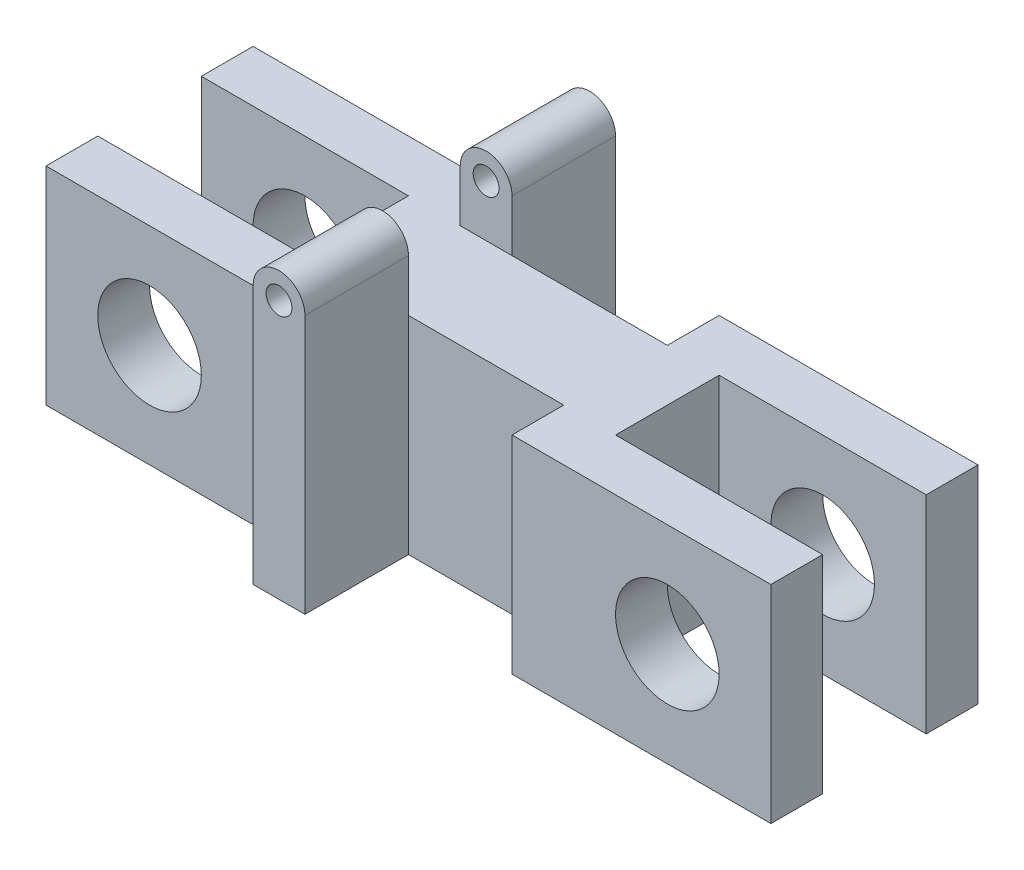
from build123d import *

# Parameters (mm, degrees)
SKETCH1_W               = 70
SKETCH1_H               = 20
BOSS_EXTRUDE1_DEPTH     = 20
SKETCH2_W               = 10
SKETCH2_H               = 20
CUT_EXTRUDE1_DEPTH      = 20
SKETCH3_R               = 5
CUT_EXTRUDE2_DEPTH      = 60
SKETCH4_W               = 10
SKETCH4_H               = 20
CUT_EXTRUDE3_DEPTH      = 5
MIRROR3_COPY_1_SKETCH_W = 10
MIRROR3_COPY_1_SKETCH_H = 20
MIRROR3_COPY_1_DEPTH    = 5
SKETCH7_R               = 1.25
BOSS_EXTRUDE2_DEPTH     = 10


with BuildPart() as part:
    # Sketch1 → Boss-Extrude1 (new body)
    with BuildSketch(Plane.XY):
        Rectangle(SKETCH1_W, SKETCH1_H)
    extrude(amount=BOSS_EXTRUDE1_DEPTH)

    # Sketch2 → Cut-Extrude1 (cut)
    with BuildSketch(Plane.ZY.offset(35)):
        with Locations((10, 0)):
            Rectangle(SKETCH2_W, SKETCH2_H)
    cut_extrude1 = extrude(amount=-CUT_EXTRUDE1_DEPTH, mode=Mode.SUBTRACT)

    # Sketch3 → Cut-Extrude2 (cut)
    with BuildSketch(Plane.XY.offset(20)):
        with Locations((-25, 0)):
            Circle(SKETCH3_R)
    cut_extrude2 = extrude(amount=-CUT_EXTRUDE2_DEPTH, mode=Mode.SUBTRACT)

    # Sketch4 → Cut-Extrude3 (cut)
    with BuildSketch(Plane.XY.offset(20)):
        with Locations((-5, 0)):
            Rectangle(SKETCH4_W, SKETCH4_H)
    cut_extrude3 = extrude(amount=-CUT_EXTRUDE3_DEPTH, mode=Mode.SUBTRACT)

    # Mirror2: Cut-Extrude3 across plane
    add(cut_extrude3.mirror(Plane.XY.offset(10)), mode=Mode.SUBTRACT)

    # Mirror3: Cut-Extrude1, Cut-Extrude2, Cut-Extrude3 across plane
    add(cut_extrude1.mirror(Plane(origin=(0, 0, 0), x_dir=(0, 0, 1), z_dir=(1, 0, 0))), mode=Mode.SUBTRACT)
    add(cut_extrude2.mirror(Plane(origin=(0, 0, 0), x_dir=(0, 0, 1), z_dir=(1, 0, 0))), mode=Mode.SUBTRACT)
    add(cut_extrude3.mirror(Plane(origin=(0, 0, 0), x_dir=(0, 0, 1), z_dir=(1, 0, 0))), mode=Mode.SUBTRACT)

    # Mirror3 copy 1 sketch → Mirror3 copy 1 (cut)
    with BuildSketch(Plane(origin=(0, 0, 0), x_dir=(-1, 0, 0), z_dir=(0, 0, -1))):
        with Locations((-5, 0)):
            Rectangle(MIRROR3_COPY_1_SKETCH_W, MIRROR3_COPY_1_SKETCH_H)
    extrude(amount=-MIRROR3_COPY_1_DEPTH, mode=Mode.SUBTRACT)

    # Sketch7 → Boss-Extrude2 (add)
    with BuildSketch(Plane.XY.offset(15)):
        with BuildLine():
            Line((-10, -10), (-10, 15))
            ThreePointArc((-10, 15), (-7.5, 17.5), (-5, 15))
            Line((-5, 15), (-5, -10))
            Line((-5, -10), (-10, -10))
        make_face()
        with Locations((-7.5, 15)):
            Circle(SKETCH7_R, mode=Mode.SUBTRACT)
    boss_extrude2 = extrude(amount=BOSS_EXTRUDE2_DEPTH)

    # Mirror4: Boss-Extrude2 across plane
    add(boss_extrude2.mirror(Plane.XY.offset(10)))


solid = part.part
